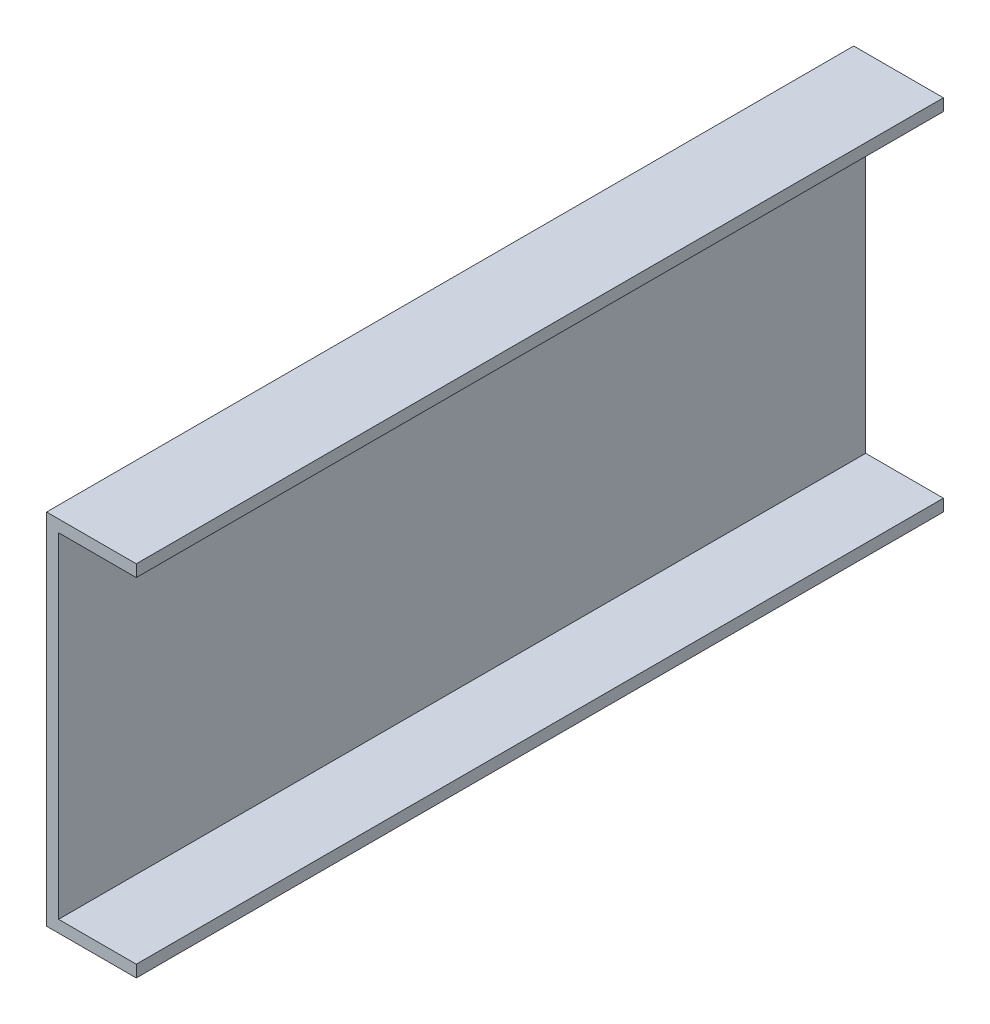
from build123d import *

# Parameters (mm, degrees)
EXTRUDE_THIN1_DEPTH = 171.45


with BuildPart() as part:
    # Sketch1 → Extrude-Thin1 (new body)
    with BuildSketch(Plane.XY):
        Polygon((-116.107664234, 49.780291971), (-135.157664234, 49.780291971), (-135.157664234, -26.419708029), (-116.107664234, -26.419708029), (-116.107664234, -23.879708029), (-132.617664234, -23.879708029), (-132.617664234, 47.240291971), (-116.107664234, 47.240291971), align=None)
    extrude(amount=EXTRUDE_THIN1_DEPTH)


solid = part.part
